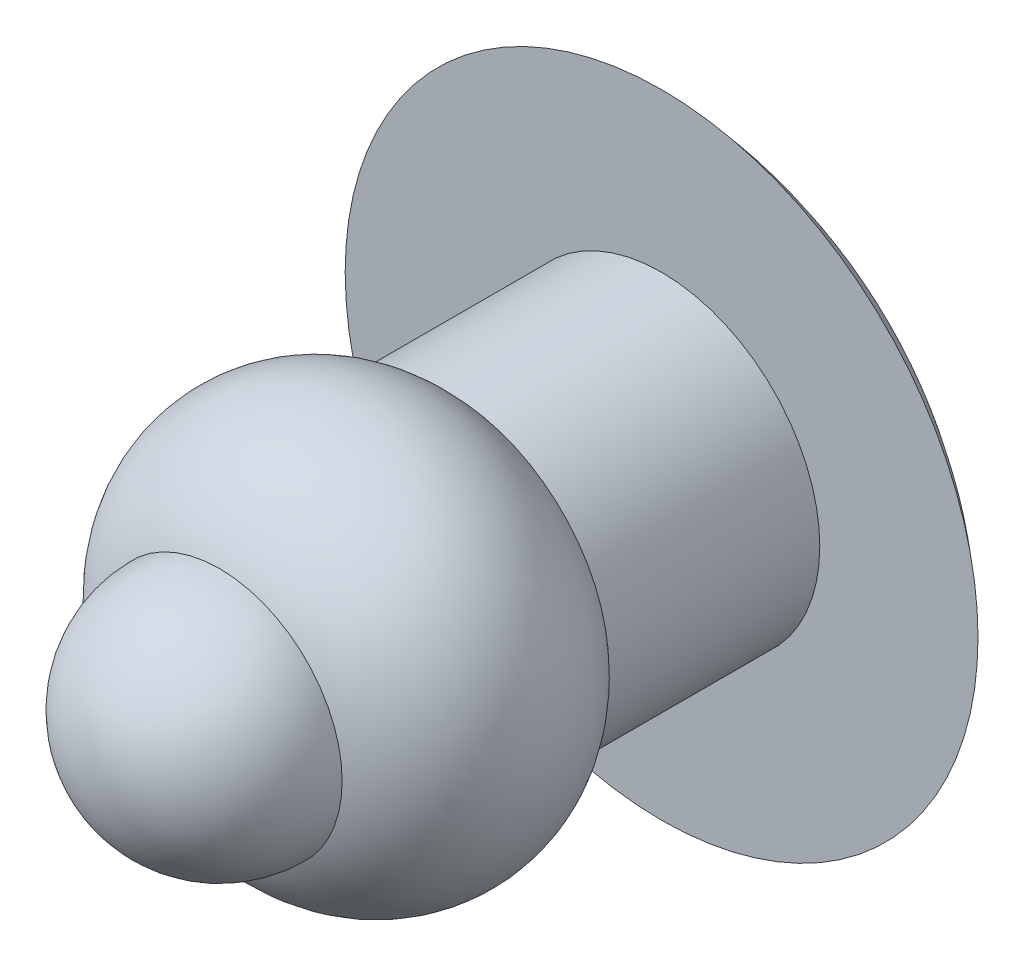
from build123d import *


with BuildPart() as part:
    # Sketch1 → Revolve1 (revolve)
    with BuildSketch(Plane(origin=(0, 0, 0), x_dir=(0, 0, -1), z_dir=(1, 0, 0)), mode=Mode.PRIVATE) as revolve1_sk:
        with BuildLine():
            Line((0, 1.5), (2, 1.5))
            Line((2, 1.5), (2, 3))
            ThreePointArc((2, 3), (2.643776387, 2.065664221), (3.033380227, 1))
            Line((3.033380227, 1), (2.833380227, 1))
            Line((2.833380227, 1), (2.833380227, 0))
            Line((2.833380227, 0), (-3.355203179, 0))
            ThreePointArc((-3.355203179, 0), (-3.014528985, 0.822460259), (-2.192068726, 1.163134453))
            ThreePointArc((-2.192068726, 1.163134453), (-1.18922755, 1.937998702), (0, 1.5))
        make_face()
    revolve(revolve1_sk.sketch.rotate(Axis((0, 0, -2.612732095), (0, 0, 1)), 90), axis=Axis((0, 0, -2.612732095), (0, 0, 1)))


solid = part.part
